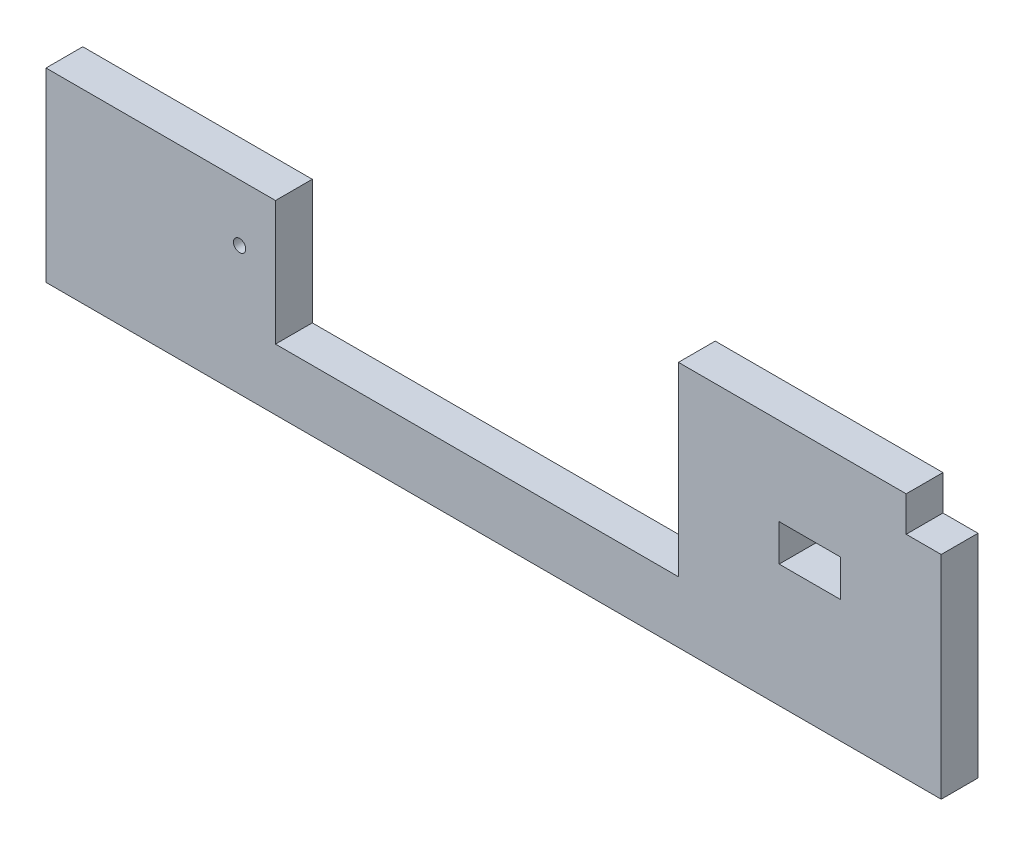
from build123d import *

# Parameters (mm, degrees)
SKETCH1_W           = 129.794
SKETCH1_H           = 24.384
BOSS_EXTRUDE1_DEPTH = 5.334
SKETCH3_W           = 58.42
SKETCH3_H           = 18.034
CUT_EXTRUDE1_DEPTH  = 104.917980915
SKETCH6_W           = 38.1
SKETCH6_H           = 5.334
BOSS_EXTRUDE2_DEPTH = 8.89
SKETCH7_W           = 5.08
SKETCH7_H           = 5.08
CUT_EXTRUDE4_DEPTH  = 104.917980915
SKETCH8_W           = 8.89
SKETCH8_H           = 5.334
CUT_EXTRUDE5_DEPTH  = 104.917980915
SKETCH4_R           = 0.889
CUT_EXTRUDE6_DEPTH  = 104.917980915
SKETCH9_W           = 129.794
SKETCH9_H           = 5.334
BOSS_EXTRUDE3_DEPTH = 2.54


with BuildPart() as part:
    # Sketch1 → Boss-Extrude1 (new body)
    with BuildSketch(Plane.XY):
        with Locations((-20.165445418, -47.262819662)):
            Rectangle(SKETCH1_W, SKETCH1_H)
    extrude(amount=BOSS_EXTRUDE1_DEPTH)

    # Sketch3 → Cut-Extrude1 (cut, through all)
    with BuildSketch(Plane.XY.offset(5.334)):
        with Locations((-22.578445418, -44.087819662)):
            Rectangle(SKETCH3_W, SKETCH3_H)
    extrude(amount=-CUT_EXTRUDE1_DEPTH, mode=Mode.SUBTRACT)

    # Sketch6 → Boss-Extrude2 (add)
    with BuildSketch(Plane(origin=(0, -35.070819662, 0), x_dir=(1, 0, 0), z_dir=(0, 1, 0))):
        with Locations((25.681554582, -2.667)):
            Rectangle(SKETCH6_W, SKETCH6_H)
    extrude(amount=BOSS_EXTRUDE2_DEPTH)

    # Sketch7 → Cut-Extrude4 (cut, through all)
    with BuildSketch(Plane.XY.offset(5.334)):
        with Locations((42.191554582, -28.720819662)):
            Rectangle(SKETCH7_W, SKETCH7_H)
    extrude(amount=-CUT_EXTRUDE4_DEPTH, mode=Mode.SUBTRACT)

    # Sketch8 → Cut-Extrude5 (cut, through all)
    with BuildSketch(Plane.XY.offset(5.334)):
        with Locations((25.681554582, -41.547819662)):
            Rectangle(SKETCH8_W, SKETCH8_H)
    extrude(amount=-CUT_EXTRUDE5_DEPTH, mode=Mode.SUBTRACT)

    # Sketch4 → Cut-Extrude6 (cut, through all)
    with BuildSketch(Plane.XY.offset(5.334)):
        with Locations((-56.995445418, -43.325819662)):
            Circle(SKETCH4_R)
    extrude(amount=-CUT_EXTRUDE6_DEPTH, mode=Mode.SUBTRACT)

    # Sketch9 → Boss-Extrude3 (add)
    with BuildSketch(Plane(origin=(0, -59.454819662, 0), x_dir=(-1, 0, 0), z_dir=(0, -1, 0))):
        with Locations((20.165445418, -2.667)):
            Rectangle(SKETCH9_W, SKETCH9_H)
    extrude(amount=BOSS_EXTRUDE3_DEPTH)


solid = part.part
